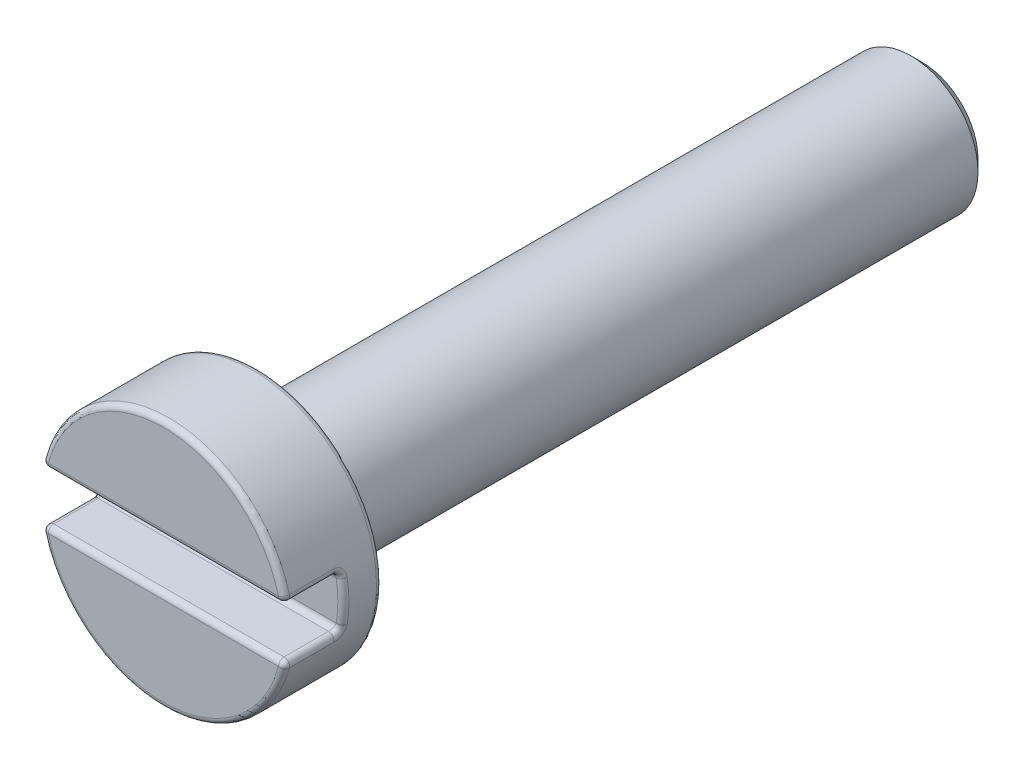
from build123d import *

# Parameters (mm, degrees)
SKIZZE2_W                       = 4.5
SKIZZE2_H                       = 0.9
SCHNITT_LINEAR_AUSTRAGEN1_DEPTH = 1
FASE1_SIZE                      = 0.2
VERRUNDUNG2_R                   = 0.1


with BuildPart() as part:
    # Skizze1 → Rotation1 (revolve)
    with BuildSketch(Plane(origin=(0, 0, 0), x_dir=(0, 0, -1), z_dir=(1, 0, 0))):
        Polygon((-1.7, 0), (-1.7, 2.25), (0, 2.25), (0, 1.21), (12, 1.21), (12, 0), align=None)
    revolve(axis=Axis((0, 0, 21.919879518), (0, 0, -1)))

    # Skizze2 → Schnitt-Linear austragen1 (cut)
    with BuildSketch(Plane.XY.offset(1.7)):
        Rectangle(SKIZZE2_W, SKIZZE2_H)
    extrude(amount=-SCHNITT_LINEAR_AUSTRAGEN1_DEPTH, mode=Mode.SUBTRACT)

    # Fase1
    fase1_edges = [part.edges().sort_by_distance(p)[0] for p in [
        (0, -1.21, -12),
    ]]
    chamfer(fase1_edges, length=FASE1_SIZE)

    # Verrundung2
    verrundung2_edges = [part.edges().sort_by_distance(p)[0] for p in [
        (0, 0.45, 1.7),
        (0, -2.25, 0),
        (2.204540769, -0.45, 1.2),
        (2.25, 0, 0.7),
        (2.204540769, 0.45, 1.2),
        (1.423024947, 1.742842506, 1.7),
        (-2.204540769, 0.45, 1.2),
        (-2.25, 0, 0.7),
        (-2.204540769, -0.45, 1.2),
        (0, -2.25, 1.7),
        (0, 0.45, 0.7),
        (0, -0.45, 0.7),
        (0, -0.45, 1.7),
    ]]
    fillet(verrundung2_edges, radius=VERRUNDUNG2_R)


solid = part.part
